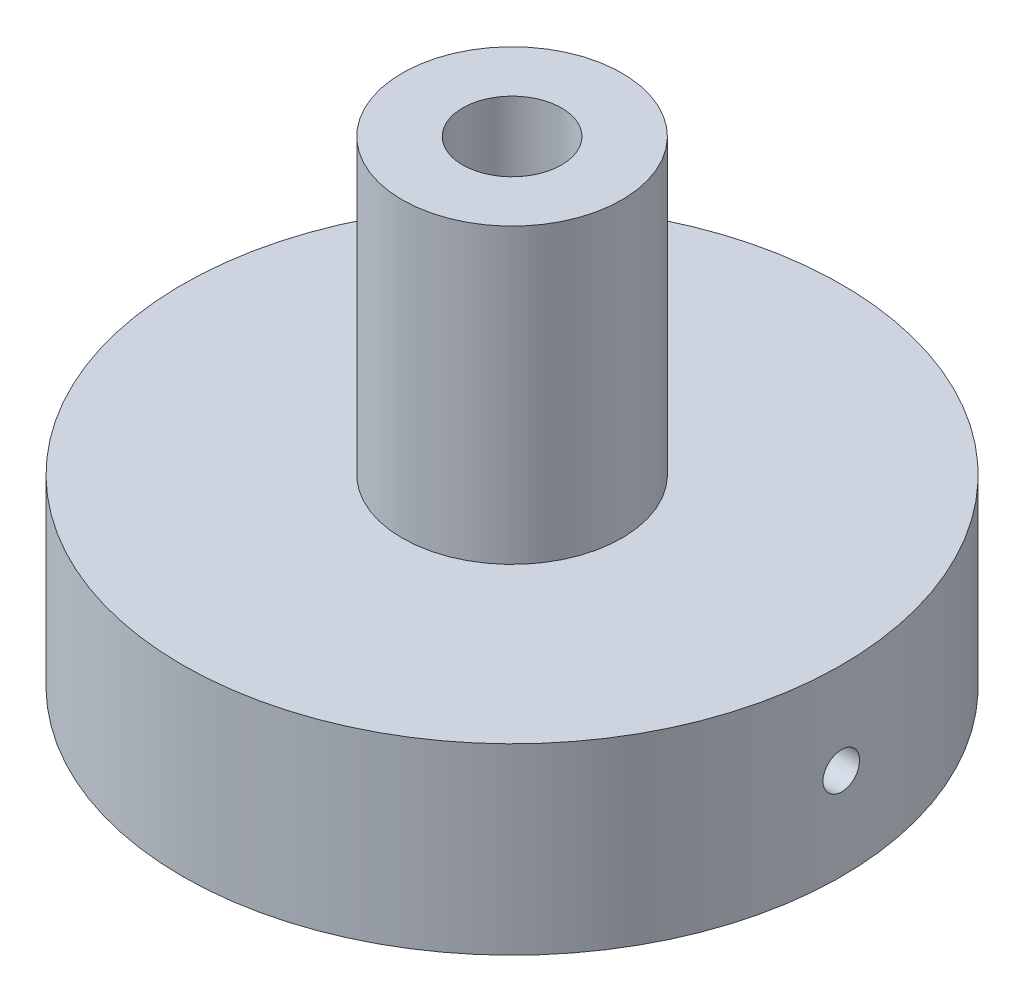
from build123d import *

# Parameters (mm, degrees)
SKETCH1_R           = 4.5
BOSS_EXTRUDE1_DEPTH = 2.5
SKETCH2_R           = 1.5
SKETCH2_R_2         = 0.675
BOSS_EXTRUDE2_DEPTH = 4
SKETCH3_W           = 4.5
SKETCH3_H           = 0.25
SKETCH5_R           = 0.406492391
CUT_EXTRUDE2_DEPTH  = 2


with BuildPart() as part:
    # Sketch1 → Boss-Extrude1 (new body)
    with BuildSketch(Plane(origin=(0, 0, 0), x_dir=(1, 0, 0), z_dir=(0, 1, 0))):
        with Locations(Location((0, 0, 0), (0, 0, 270))):
            Circle(SKETCH1_R)
    extrude(amount=BOSS_EXTRUDE1_DEPTH)

    # Sketch2 → Boss-Extrude2 (add)
    with BuildSketch(Plane(origin=(0, 2.5, 0), x_dir=(1, 0, 0), z_dir=(0, 1, 0))):
        with Locations(Location((0, 0, 0), (0, 0, 270))):
            Circle(SKETCH2_R)
        with Locations(Location((0, 0, 0), (0, 0, 270))):
            Circle(SKETCH2_R_2, mode=Mode.SUBTRACT)
    extrude(amount=BOSS_EXTRUDE2_DEPTH)

    # Sketch3 → Cut-Revolve1 (revolve, cut)
    with BuildSketch(Plane.XY, mode=Mode.PRIVATE) as cut_revolve1_sk:
        with Locations((2.25, 1.375)):
            Rectangle(SKETCH3_W, SKETCH3_H)
    revolve(cut_revolve1_sk.sketch.rotate(Axis((0, 1.25, 0), (1, 0, 0)), 90), axis=Axis((0, 1.25, 0), (1, 0, 0)), mode=Mode.SUBTRACT)

    # Sketch5 → Cut-Extrude2 (cut)
    with BuildSketch(Plane(origin=(0, 2.5, 0), x_dir=(1, 0, 0), z_dir=(0, 1, 0))):
        with Locations(Location((0, 0, 0), (0, 0, 270))):
            Circle(SKETCH5_R)
    extrude(amount=-CUT_EXTRUDE2_DEPTH, mode=Mode.SUBTRACT)


solid = part.part
